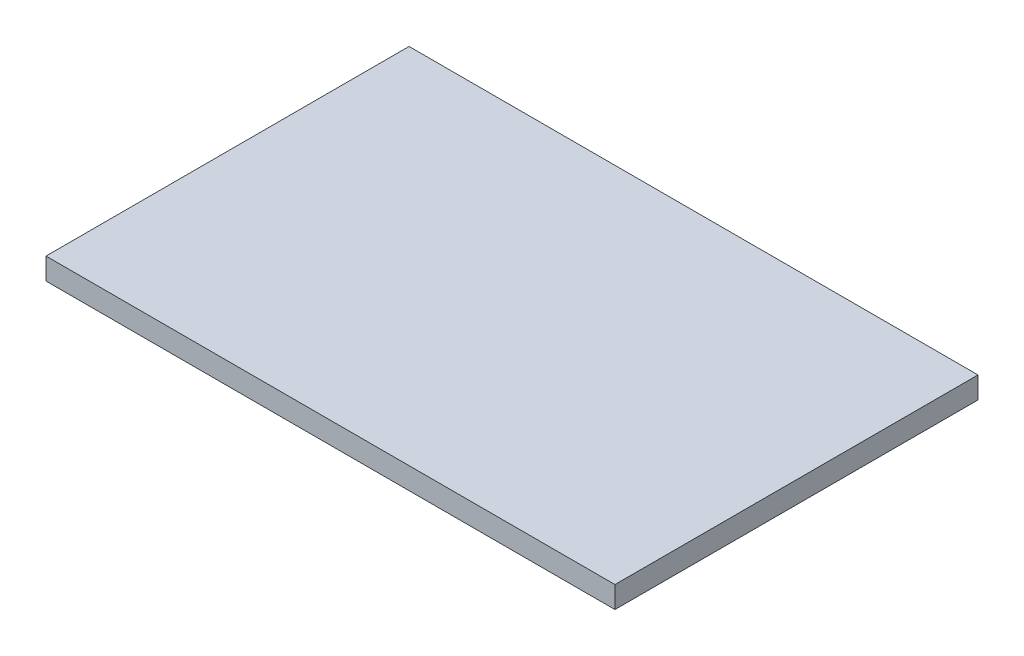
from build123d import *

# Parameters (mm, degrees)
SKETCH_1_W      = 105
SKETCH_1_H      = 67
EXTRUDE_1_DEPTH = 4


with BuildPart() as part:
    # 草图1 → 凸台-拉伸1 (new body)
    with BuildSketch(Plane(origin=(0, 0, 0), x_dir=(1, 0, 0), z_dir=(0, 1, 0))):
        with Locations((52.5, -33.5)):
            Rectangle(SKETCH_1_W, SKETCH_1_H)
    extrude(amount=EXTRUDE_1_DEPTH)


solid = part.part
